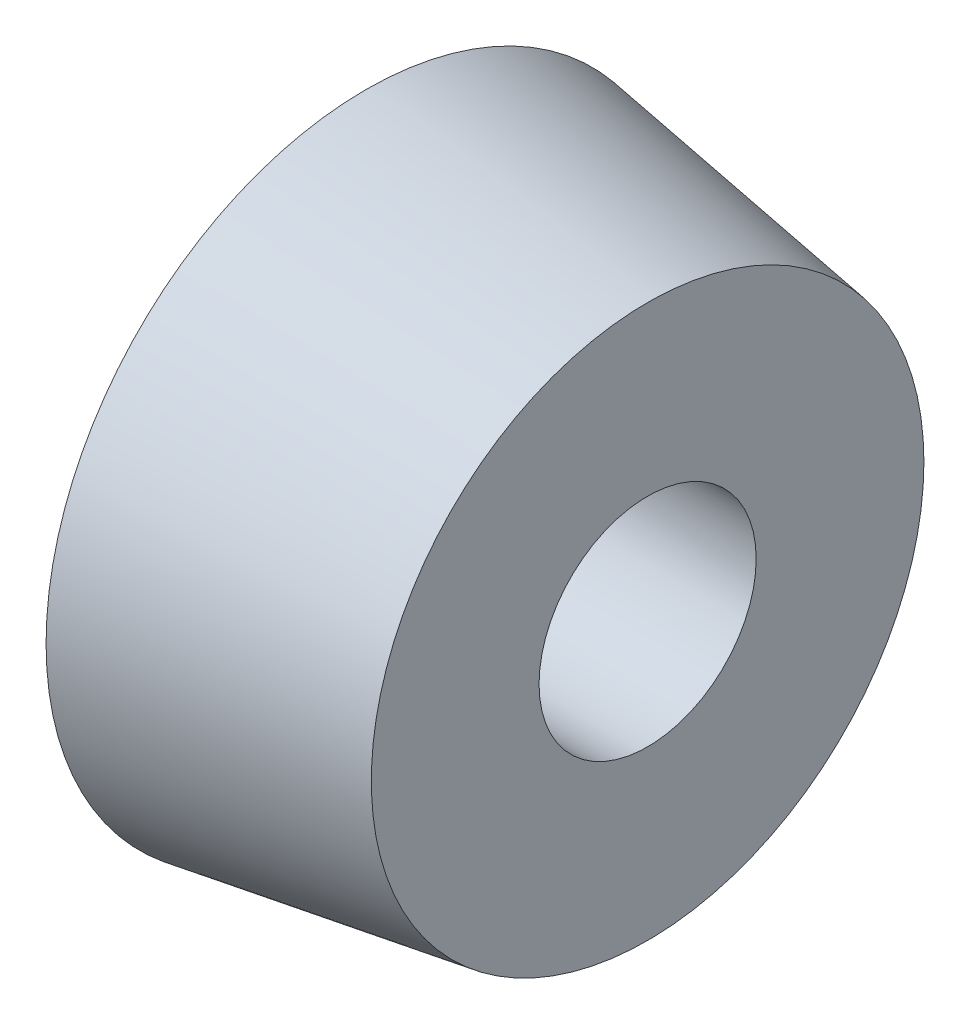
from build123d import *

# Parameters (mm, degrees)
TAPPED_HOLE_FOR_9_16_12_HELICOIL1_D = 14.68374


with BuildPart() as part:
    # Sketch1 → Revolve2 (revolve)
    with BuildSketch(Plane(origin=(0, 0, 0), x_dir=(1, 0, 0), z_dir=(0, 1, 0))):
        Polygon((929.772285353, 97.830519041), (929.772285353, 76.2), (948.822285353, 76.2), (948.822285353, 94.885801773), align=None)
    revolve(axis=Axis((1049.721128595, 0, -76.2), (-1, 0, 0)))

    # Tapped Hole for 9/16-12 Helicoil1 (through all)
    with Locations(Plane.ZY.offset(-929.772285353)):
        with Locations((-76.2, 0)):
            Hole(TAPPED_HOLE_FOR_9_16_12_HELICOIL1_D / 2)

    # Sketch5 → Cut-Revolve1 (revolve, cut)
    with BuildSketch(Plane(origin=(0, 0, 0), x_dir=(1, 0, 0), z_dir=(0, 1, 0))):
        with BuildLine():
            Line((927.609152682, 95.594725662), (927.609152682, 86.08187))
            Line((927.609152682, 86.08187), (943.107285353, 86.08187))
            ThreePointArc((943.107285353, 86.08187), (945.352349383, 87.01180597), (946.282285353, 89.25687))
            Line((946.282285353, 89.25687), (946.282285353, 89.986341597))
            ThreePointArc((946.282285353, 89.986341597), (945.517739835, 92.052820291), (943.592311059, 93.124075663))
            Line((943.592311059, 93.124075663), (927.609152682, 95.594725662))
        make_face()
    revolve(axis=Axis((1049.721128595, 0, -76.2), (-1, 0, 0)), mode=Mode.SUBTRACT)


solid = part.part
